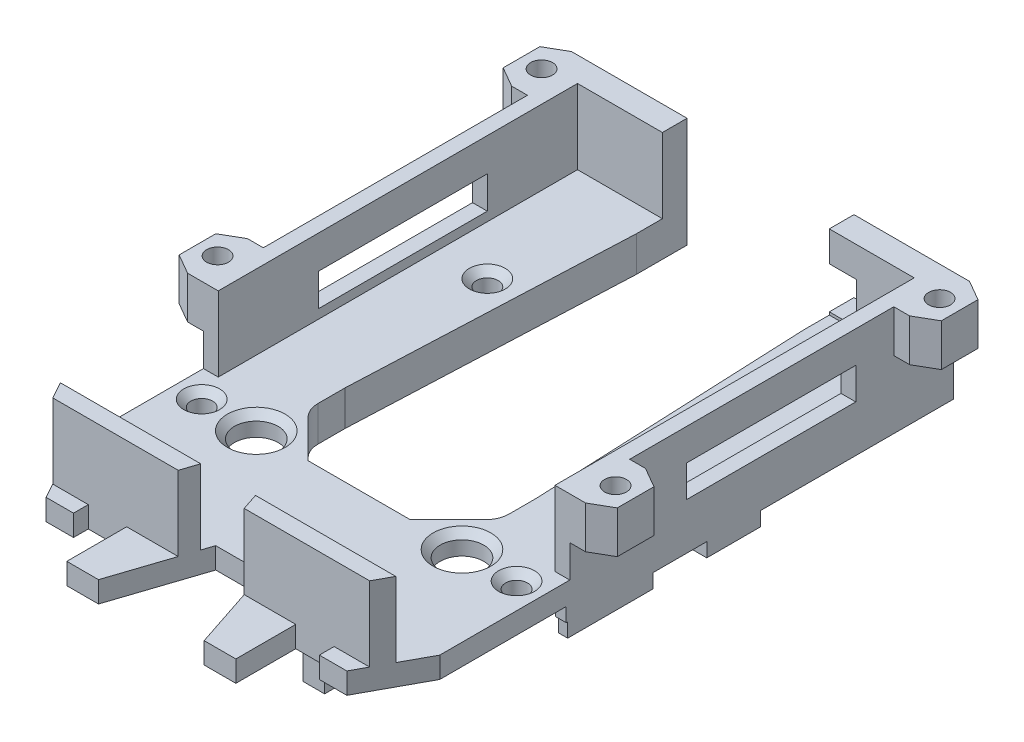
from build123d import *

# Parameters (mm, degrees)
SKETCH_12157_R           = 1.55
SKETCH_12157_R_2         = 3.1
F_3MM_1_5MM_DEPTH        = 3
EXTRUDE_START            = -2
EXTRUDE_25031_DEPTH      = 2
SKETCH_5_W               = 4.1
SKETCH_5_H               = 8.5
SKETCH_5_W_2             = 3.1
SKETCH_5_H_2             = 7.5
EXTRUDE_32283_DEPTH      = 3
EXTRUDE_2_DEPTH          = 2
EXTRUDE_START_2          = 3
SKETCH_5_5_W             = 3.1
SKETCH_5_5_H             = 7.5
EXTRUDE_33009_DEPTH      = 7
EXTRUDE_34199_DEPTH      = 3
EXTRUDE_34199_DEPTH_BACK = 2
SKETCH2_R                = 1.55
SKETCH3_W                = 3.301126091
SKETCH3_H                = 7.6
SKETCH3_W_2              = 1.3
SKETCH3_H_2              = 12.1
EXTRUDE_40784_DEPTH      = 4
CHAMFER_40857_SIZE       = 1
EXTRUDE_42917_DEPTH      = 10.6
EXTRUDE_START_3          = 13.6
SKETCH_10_R              = 1.55
EXTRUDE_3_DEPTH          = 6
SKETCH_43735_W           = 24
SKETCH_43735_H           = 4.5
SKETCH_43735_W_2         = 23
SKETCH_43735_H_2         = 3.5
CUT_EXTRUDE_45378_DEPTH  = 167.496967072
SKETCH_44281_W           = 24
SKETCH_44281_H           = 4.6
SKETCH_44281_W_2         = 23
SKETCH_44281_H_2         = 3.6
CUT_EXTRUDE_45445_DEPTH  = 167.496967072
XT30_START               = 75.1
XT30_2_W                 = 11.2
XT30_2_H                 = 5.9
XT30_2_W_2               = 10.2
XT30_2_H_2               = 4.9
XT30_DEPTH               = 77


with BuildPart() as part:
    # Sketch 12157 → 基座_3mm_留线槽空间1.5mm (new body)
    with BuildSketch(Plane(origin=(0, 0, 0), x_dir=(1, 0, 0), z_dir=(0, 1, 0))):
        with BuildLine():
            Line((-24.501126091, -125.026398932), (-17.042092951, -115.35))
            Line((-17.042092951, -115.35), (-13.292092951, -115.35))
            Line((-13.292092951, -115.35), (-13.576089496, -121.85459027))
            Line((-13.576089496, -121.85459027), (-13.579301748, -122.001805703))
            Line((-13.579301748, -122.001805703), (-13.579301748, -125.768411616))
            ThreePointArc((-13.579301748, -125.768411616), (-13.322655903, -127.059338556), (-12.591750717, -128.153933031))
            Line((-12.591750717, -128.153933031), (-7.25, -133.5))
            Line((-7.25, -133.5), (7.25, -133.5))
            Line((7.25, -133.5), (12.591750717, -128.153933031))
            ThreePointArc((12.591750717, -128.153933031), (13.322655903, -127.059338556), (13.579301748, -125.768411616))
            Line((13.579301748, -125.768411616), (13.579301748, -122.001805703))
            Line((13.579301748, -122.001805703), (13.576089496, -121.85459027))
            Line((13.576089496, -121.85459027), (13.292092951, -115.35))
            Line((13.292092951, -115.35), (17.042092951, -115.35))
            Line((17.042092951, -115.35), (24.501126091, -125.026398932))
            Line((24.501126091, -125.026398932), (26.001126091, -126.6))
            Line((26.001126091, -126.6), (26.001126091, -130.1))
            Line((26.001126091, -130.1), (26.001126091, -148.0463267))
            Line((26.001126091, -148.0463267), (21.353443149, -156.6))
            Line((21.353443149, -156.6), (17.45, -156.6))
            Line((17.45, -156.6), (17.45, -154.5))
            Line((17.45, -154.5), (16.1, -154.5))
            Line((16.1, -154.5), (16.1, -146))
            Line((16.1, -146), (12, -146))
            Line((12, -146), (12, -163))
            Line((12, -163), (7.5, -163))
            Line((7.5, -163), (3.358391833, -150.5))
            Line((3.358391833, -150.5), (-3.358391833, -150.5))
            Line((-3.358391833, -150.5), (-7.5, -163))
            Line((-7.5, -163), (-12, -163))
            Line((-12, -163), (-12, -146))
            Line((-12, -146), (-16.1, -146))
            Line((-16.1, -146), (-16.1, -154.5))
            Line((-16.1, -154.5), (-17.45, -154.5))
            Line((-17.45, -154.5), (-17.45, -156.6))
            Line((-17.45, -156.6), (-21.353443149, -156.6))
            Line((-21.353443149, -156.6), (-26.001126091, -148.0463267))
            Line((-26.001126091, -148.0463267), (-26.001126091, -130.1))
            Line((-26.001126091, -130.1), (-26.001126091, -126.6))
            Line((-26.001126091, -126.6), (-24.501126091, -125.026398932))
        make_face()
        with Locations(Location((-22.35, -133.5, 0), (0, 0, 90))):
            Circle(SKETCH_12157_R, mode=Mode.SUBTRACT)
        with Locations(Location((-14.6, -133.5, 0), (0, 0, 90))):
            Circle(SKETCH_12157_R_2, mode=Mode.SUBTRACT)
        with Locations(Location((14.6, -133.5, 0), (0, 0, 270))):
            Circle(SKETCH_12157_R_2, mode=Mode.SUBTRACT)
        with Locations(Location((22.35, -133.5, 0), (0, 0, 270))):
            Circle(SKETCH_12157_R, mode=Mode.SUBTRACT)
    extrude(amount=F_3MM_1_5MM_DEPTH)

    # Sketch 24747 → Extrude 25031 (add)
    with BuildSketch(Plane(origin=(0, 0, 0), x_dir=(1, 0, 0), z_dir=(0, 1, 0)).offset(EXTRUDE_START)):
        with BuildLine():
            Line((13.292092951, -115.35), (17.042092951, -115.35))
            Line((17.042092951, -115.35), (24.501126091, -125.026398932))
            Line((24.501126091, -125.026398932), (24.501126091, -128.153933031))
            Line((24.501126091, -128.153933031), (12.591750717, -128.153933031))
            ThreePointArc((12.591750717, -128.153933031), (13.322655903, -127.059338556), (13.579301748, -125.768411616))
            Line((13.579301748, -125.768411616), (13.579301748, -122.001805703))
            ThreePointArc((13.579301748, -122.001805703), (13.578498589, -121.928180466), (13.576089496, -121.85459027))
            Line((13.576089496, -121.85459027), (13.292092951, -115.35))
        make_face()
        with BuildLine():
            Line((-13.292092951, -115.35), (-13.576089496, -121.85459027))
            ThreePointArc((-13.576089496, -121.85459027), (-13.578498589, -121.928180466), (-13.579301748, -122.001805703))
            Line((-13.579301748, -122.001805703), (-13.579301748, -125.768411616))
            ThreePointArc((-13.579301748, -125.768411616), (-13.322655903, -127.059338556), (-12.591750717, -128.153933031))
            Line((-12.591750717, -128.153933031), (-24.501126091, -128.153933031))
            Line((-24.501126091, -128.153933031), (-24.501126091, -125.026398932))
            Line((-24.501126091, -125.026398932), (-17.042092951, -115.35))
            Line((-17.042092951, -115.35), (-13.292092951, -115.35))
        make_face()
    extrude(amount=EXTRUDE_25031_DEPTH)

    # 草图5 → Extrude 32283 (add)
    # profile 1 of 8: a face of its own
    with BuildSketch(Plane(origin=(0, 0, 0), x_dir=(1, 0, 0), z_dir=(0, 1, 0))):
        with Locations((-14.05, -150.25)):
            Rectangle(SKETCH_5_W, SKETCH_5_H)
        with Locations((-14.05, -150.25)):
            Rectangle(SKETCH_5_W_2, SKETCH_5_H_2, mode=Mode.SUBTRACT)
    # profile 2 of 8: a face of its own
    with BuildSketch(Plane(origin=(0, 0, 0), x_dir=(1, 0, 0), z_dir=(0, 1, 0))):
        with Locations((-14.05, -150.25)):
            Rectangle(SKETCH_5_W_2, SKETCH_5_H_2)
    # profile 3 of 8: a face of its own
    with BuildSketch(Plane(origin=(0, 0, 0), x_dir=(1, 0, 0), z_dir=(0, 1, 0))):
        with Locations((14.05, -150.25)):
            Rectangle(SKETCH_5_W, SKETCH_5_H)
        with Locations((14.05, -150.25)):
            Rectangle(SKETCH_5_W_2, SKETCH_5_H_2, mode=Mode.SUBTRACT)
    # profile 4 of 8: a face of its own
    with BuildSketch(Plane(origin=(0, 0, 0), x_dir=(1, 0, 0), z_dir=(0, 1, 0))):
        with Locations((14.05, -150.25)):
            Rectangle(SKETCH_5_W_2, SKETCH_5_H_2)
    # profile 5 of 8: a face of its own
    with BuildSketch(Plane(origin=(0, 0, 0), x_dir=(1, 0, 0), z_dir=(0, 1, 0))):
        Polygon((-24.701126091, -125.236212408), (-26.001126091, -126.6), (-26.001126091, -129.9), (-24.701126091, -129.9), align=None)
    # profile 6 of 8: a face of its own
    with BuildSketch(Plane(origin=(0, 0, 0), x_dir=(1, 0, 0), z_dir=(0, 1, 0))):
        Polygon((-26.001126091, -130.1), (-26.001126091, -129.9), (-24.701126091, -129.9), (-24.701126091, -125.236212408), (-24.501126091, -125.026398932), (-24.501126091, -130.1), align=None)
    # profile 7 of 8: a face of its own
    with BuildSketch(Plane(origin=(0, 0, 0), x_dir=(1, 0, 0), z_dir=(0, 1, 0))):
        Polygon((26.001126091, -126.6), (26.001126091, -129.9), (24.701126091, -129.9), (24.701126091, -125.236212408), align=None)
    # profile 8 of 8: a face of its own
    with BuildSketch(Plane(origin=(0, 0, 0), x_dir=(1, 0, 0), z_dir=(0, 1, 0))):
        Polygon((24.501126091, -130.1), (26.001126091, -130.1), (26.001126091, -129.9), (24.701126091, -129.9), (24.701126091, -125.236212408), (24.501126091, -125.026398932), align=None)
    extrude(amount=EXTRUDE_32283_DEPTH)

    # 草图5<6> → 结构填充-2 (add)
    with BuildSketch(Plane(origin=(0, 0, 0), x_dir=(1, 0, 0), z_dir=(0, 1, 0))):
        Polygon((26.001126091, -126.6), (26.001126091, -129.9), (24.701126091, -129.9), (24.701126091, -125.236212408), align=None)
        Polygon((24.501126091, -130.1), (26.001126091, -130.1), (26.001126091, -129.9), (24.701126091, -129.9), (24.701126091, -125.236212408), (24.501126091, -125.026398932), align=None)
        Polygon((-24.701126091, -125.236212408), (-26.001126091, -126.6), (-26.001126091, -129.9), (-24.701126091, -129.9), align=None)
        Polygon((-26.001126091, -130.1), (-26.001126091, -129.9), (-24.701126091, -129.9), (-24.701126091, -125.236212408), (-24.501126091, -125.026398932), (-24.501126091, -130.1), align=None)
    extrude(amount=-EXTRUDE_2_DEPTH)

    # 草图5<5> → Extrude 33009 (add)
    with BuildSketch(Plane(origin=(0, 0, 0), x_dir=(1, 0, 0), z_dir=(0, 1, 0)).offset(EXTRUDE_START_2)):
        with Locations((-14.05, -150.25)):
            Rectangle(SKETCH_5_5_W, SKETCH_5_5_H)
        with Locations((14.05, -150.25)):
            Rectangle(SKETCH_5_5_W, SKETCH_5_5_H)
        Polygon((-24.701126091, -125.236212408), (-24.701126091, -129.9), (-26.001126091, -129.9), (-26.001126091, -126.6), align=None)
        Polygon((24.701126091, -125.236212408), (24.701126091, -129.9), (26.001126091, -129.9), (26.001126091, -126.6), align=None)
    extrude(amount=-EXTRUDE_33009_DEPTH)

    # Sketch2 → Extrude 34199 (add, two sides: drawn at the far end of the back side and taken through both)
    # profile 1 of 2: a face of its own
    with BuildSketch(Plane(origin=(0, 0, 0), x_dir=(1, 0, 0), z_dir=(0, 1, 0)).offset(-EXTRUDE_34199_DEPTH_BACK)):
        Polygon((-24.501126091, -125.026398932), (-17.042092951, -115.35), (-13.292092951, -115.35), (-11.848710623, -82.291109542), (-11.848710623, -75.1), (-26.001126091, -75.1), (-26.001126091, -126.6), align=None)
        with Locations(Location((-16.9, -98.4, 0), (0, 0, 270))):
            Circle(SKETCH2_R, mode=Mode.SUBTRACT)
    # profile 2 of 2: a face of its own
    with BuildSketch(Plane(origin=(0, 0, 0), x_dir=(1, 0, 0), z_dir=(0, 1, 0)).offset(-EXTRUDE_34199_DEPTH_BACK)):
        Polygon((24.501126091, -125.026398932), (17.042092951, -115.35), (13.292092951, -115.35), (11.848710623, -82.291109542), (11.848710623, -75.1), (26.001126091, -75.1), (26.001126091, -126.6), align=None)
        with Locations(Location((16.9, -98.4, 0), (0, 0, 90))):
            Circle(SKETCH2_R, mode=Mode.SUBTRACT)
    extrude(amount=EXTRUDE_34199_DEPTH + EXTRUDE_34199_DEPTH_BACK)

    # Sketch3 → Extrude 40784 (add)
    with BuildSketch(Plane(origin=(0, 0, 0), x_dir=(1, 0, 0), z_dir=(0, 1, 0))):
        with Locations((-24.350563046, -106.35)):
            Rectangle(SKETCH3_W, SKETCH3_H)
        with Locations((-25.351126091, -123.85)):
            Rectangle(SKETCH3_W_2, SKETCH3_H_2)
        with Locations((25.351126091, -123.85)):
            Rectangle(SKETCH3_W_2, SKETCH3_H_2)
        with Locations((24.350563046, -106.35)):
            Rectangle(SKETCH3_W, SKETCH3_H)
    extrude(amount=-EXTRUDE_40784_DEPTH)

    # Chamfer 40857
    chamfer_40857_edges = [part.edges().sort_by_distance(p)[0] for p in [
        (22.35, 3, 131.95),
        (-22.35, 3, 135.05),
        (-14.6, 3, 136.6),
        (-16.9, 3, 96.85),
        (16.9, 3, 99.95),
        (14.6, 3, 130.4),
    ]]
    chamfer(chamfer_40857_edges, length=CHAMFER_40857_SIZE)

    # Sketch4 → Extrude 42917 (add)
    with BuildSketch(Plane(origin=(0, 3, 0), x_dir=(1, 0, 0), z_dir=(0, 1, 0))):
        Polygon((-11.848710623, -78.6), (-11.848710623, -75.1), (-26.001126091, -75.1), (-26.001126091, -129.6), (-23.9, -129.6), (-23.9, -78.6), align=None)
        Polygon((11.848710623, -78.6), (23.9, -78.6), (23.9, -129.6), (26.001126091, -129.6), (26.001126091, -75.1), (11.848710623, -75.1), align=None)
        Polygon((-3.888517679, -152.1), (-23.798541589, -152.1), (-22.494489088, -154.5), (-17.45, -154.5), (-12, -154.5), (-4.683706447, -154.5), align=None)
        Polygon((22.494489088, -154.5), (23.798541589, -152.1), (3.888517679, -152.1), (4.683706447, -154.5), (12, -154.5), (17.45, -154.5), align=None)
    extrude(amount=EXTRUDE_42917_DEPTH)

    # 草图10 → 凸台-拉伸3 (add)
    # profile 1 of 4: a face of its own
    with BuildSketch(Plane(origin=(0, 0, 0), x_dir=(1, 0, 0), z_dir=(0, 1, 0)).offset(EXTRUDE_START_3)):
        Polygon((26.001126091, -75.1), (26.001126091, -83.6), (28.251126091, -83.6), (31.101126091, -81.954551733), (31.101126091, -76.745448267), (28.251126091, -75.1), align=None)
        with Locations(Location((28.251126091, -79.35, 0), (0, 0, 270))):
            Circle(SKETCH_10_R, mode=Mode.SUBTRACT)
    # profile 2 of 4: a face of its own
    with BuildSketch(Plane(origin=(0, 0, 0), x_dir=(1, 0, 0), z_dir=(0, 1, 0)).offset(EXTRUDE_START_3)):
        Polygon((26.001126091, -129.6), (28.251126091, -129.6), (31.101126091, -127.954551733), (31.101126091, -122.745448267), (28.251126091, -121.1), (26.001126091, -121.1), align=None)
        with Locations(Location((28.251126091, -125.35, 0), (0, 0, 270))):
            Circle(SKETCH_10_R, mode=Mode.SUBTRACT)
    # profile 3 of 4: a face of its own
    with BuildSketch(Plane(origin=(0, 0, 0), x_dir=(1, 0, 0), z_dir=(0, 1, 0)).offset(EXTRUDE_START_3)):
        Polygon((-31.101126091, -127.954551733), (-28.251126091, -129.6), (-26.001126091, -129.6), (-26.001126091, -121.1), (-28.251126091, -121.1), (-31.101126091, -122.745448267), align=None)
        with Locations(Location((-28.251126091, -125.35, 0), (0, 0, 270))):
            Circle(SKETCH_10_R, mode=Mode.SUBTRACT)
    # profile 4 of 4: a face of its own
    with BuildSketch(Plane(origin=(0, 0, 0), x_dir=(1, 0, 0), z_dir=(0, 1, 0)).offset(EXTRUDE_START_3)):
        Polygon((-31.101126091, -81.954551733), (-28.251126091, -83.6), (-26.001126091, -83.6), (-26.001126091, -75.1), (-28.251126091, -75.1), (-31.101126091, -76.745448267), align=None)
        with Locations(Location((-28.251126091, -79.35, 0), (0, 0, 270))):
            Circle(SKETCH_10_R, mode=Mode.SUBTRACT)
    extrude(amount=-EXTRUDE_3_DEPTH)

    # Sketch 43735 → Cut-Extrude 45378 (cut, through all)
    # profile 1 of 2: a face of its own
    with BuildSketch(Plane(origin=(0, 0, 0), x_dir=(0, 0, -1), z_dir=(1, 0, 0))):
        with Locations((-101, 6.85)):
            Rectangle(SKETCH_43735_W, SKETCH_43735_H)
        with Locations((-101, 6.85)):
            Rectangle(SKETCH_43735_W_2, SKETCH_43735_H_2, mode=Mode.SUBTRACT)
    # profile 2 of 2: a face of its own
    with BuildSketch(Plane(origin=(0, 0, 0), x_dir=(0, 0, -1), z_dir=(1, 0, 0))):
        with Locations((-101, 6.85)):
            Rectangle(SKETCH_43735_W_2, SKETCH_43735_H_2)
    extrude(amount=CUT_EXTRUDE_45378_DEPTH, mode=Mode.SUBTRACT)

    # Sketch 44281 → Cut-Extrude 45445 (cut, through all)
    # profile 1 of 2: a face of its own
    with BuildSketch(Plane(origin=(0, 0, 0), x_dir=(0, 0, -1), z_dir=(1, 0, 0))):
        with Locations((-103.4, 6.6)):
            Rectangle(SKETCH_44281_W, SKETCH_44281_H)
        with Locations((-103.4, 6.6)):
            Rectangle(SKETCH_44281_W_2, SKETCH_44281_H_2, mode=Mode.SUBTRACT)
    # profile 2 of 2: a face of its own
    with BuildSketch(Plane(origin=(0, 0, 0), x_dir=(0, 0, -1), z_dir=(1, 0, 0))):
        with Locations((-103.4, 6.6)):
            Rectangle(SKETCH_44281_W_2, SKETCH_44281_H_2)
    extrude(amount=-CUT_EXTRUDE_45445_DEPTH, mode=Mode.SUBTRACT)

    # xt30 2 → xt30 (cut)
    # profile 1 of 2: a face of its own
    with BuildSketch(Plane.XY.offset(XT30_START)):
        with Locations((10.1, 6.35)):
            Rectangle(XT30_2_W, XT30_2_H)
        with Locations((10.1, 6.35)):
            Rectangle(XT30_2_W_2, XT30_2_H_2, mode=Mode.SUBTRACT)
    # profile 2 of 2: a face of its own
    with BuildSketch(Plane.XY.offset(XT30_START)):
        with Locations((10.1, 6.35)):
            Rectangle(XT30_2_W_2, XT30_2_H_2)
    extrude(amount=XT30_DEPTH, mode=Mode.SUBTRACT)


solid = part.part
